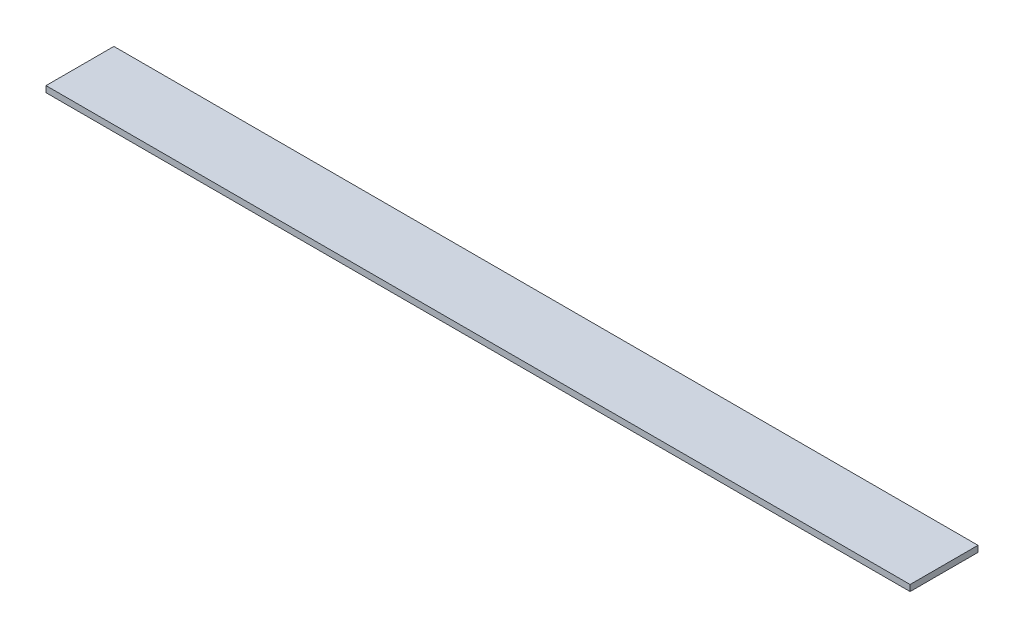
from build123d import *

# Parameters (mm, degrees)
SKETCH1_W           = 110
SKETCH1_H           = 10
BOSS_EXTRUDE1_DEPTH = 1400


with BuildPart() as part:
    # Sketch1 → Boss-Extrude1 (new body)
    with BuildSketch(Plane(origin=(0, 0, 0), x_dir=(0, 0, -1), z_dir=(1, 0, 0))):
        with Locations((55, -5)):
            Rectangle(SKETCH1_W, SKETCH1_H)
    extrude(amount=BOSS_EXTRUDE1_DEPTH)


solid = part.part
